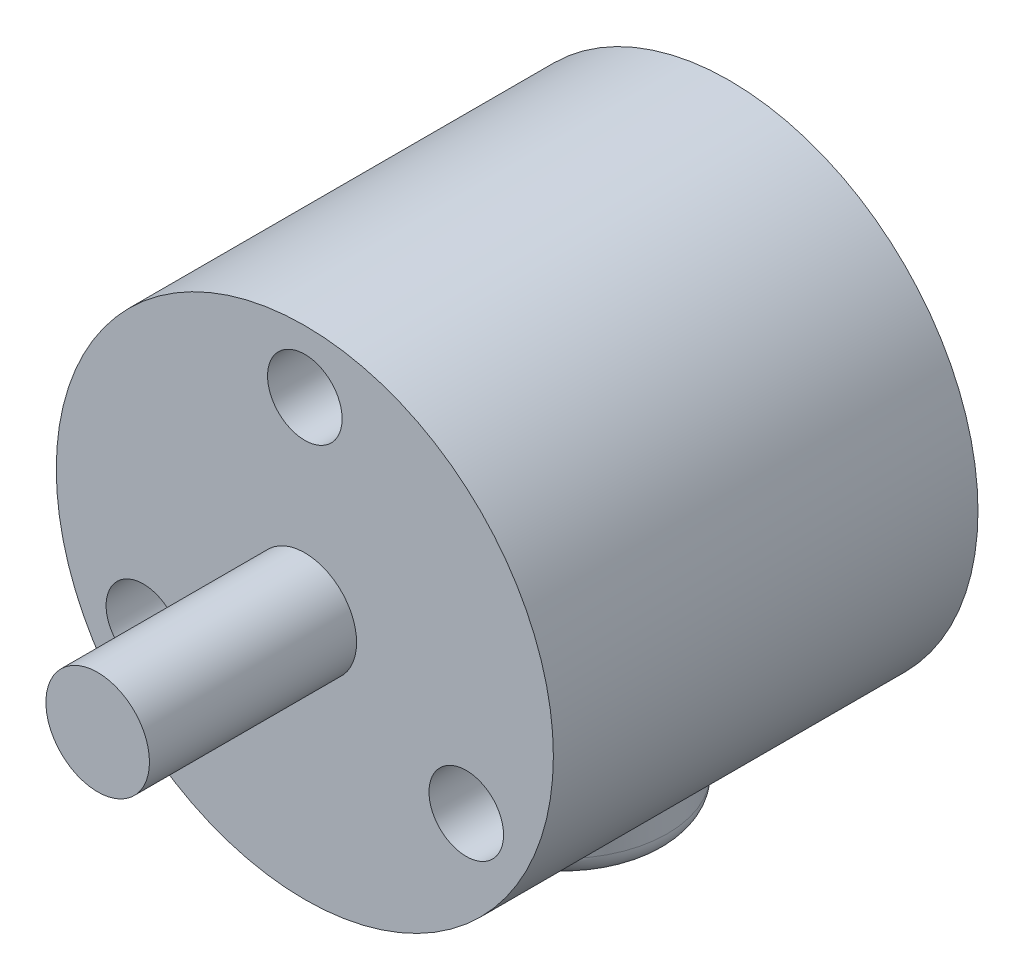
from build123d import *

# Parameters (mm, degrees)
ESQUISSE1_R             = 12
BOSS_EXTRU_1_DEPTH      = 20.5
ESQUISSE2_R             = 2.5
BOSS_EXTRU_2_DEPTH      = 3.5
ESQUISSE3_R             = 1.8
ENL_V_MAT_EXTRU_1_DEPTH = 3
ESQUISSE4_R             = 2.5
BOSS_EXTRU_3_DEPTH      = 6.5
ESQUISSE5_R             = 5
BOSS_EXTRU_4_DEPTH      = 14
CONG_1_R                = 1


with BuildPart() as part:
    # Esquisse1 → Boss.-Extru.1 (new body)
    with BuildSketch(Plane.XY):
        Circle(ESQUISSE1_R)
    extrude(amount=BOSS_EXTRU_1_DEPTH)

    # Esquisse2 → Boss.-Extru.2 (add)
    with BuildSketch(Plane.XY.offset(20.5)):
        Circle(ESQUISSE2_R)
    extrude(amount=BOSS_EXTRU_2_DEPTH)

    # Esquisse3 → Enlèv. mat.-Extru.1 (cut)
    with BuildSketch(Plane.XY.offset(20.5)):
        with Locations((0, 9)):
            Circle(ESQUISSE3_R)
        with Locations((-7.794228634, -4.5)):
            Circle(ESQUISSE3_R)
        with Locations((7.794228634, -4.5)):
            Circle(ESQUISSE3_R)
    extrude(amount=-ENL_V_MAT_EXTRU_1_DEPTH, mode=Mode.SUBTRACT)

    # Esquisse4 → Boss.-Extru.3 (add)
    with BuildSketch(Plane.XY.offset(24)):
        Circle(ESQUISSE4_R)
    extrude(amount=BOSS_EXTRU_3_DEPTH)

    # Esquisse5 → Boss.-Extru.4 (add)
    with BuildSketch(Plane(origin=(0, 0, 0), x_dir=(1, 0, 0), z_dir=(0, 1, 0))):
        with Locations(Location((0, -8, 0), (0, 0, 270))):
            Circle(ESQUISSE5_R)
    extrude(amount=-BOSS_EXTRU_4_DEPTH)

    # Congé1
    cong_1_edges = [part.edges().sort_by_distance(p)[0] for p in [
        (0, -14, 3),
    ]]
    fillet(cong_1_edges, radius=CONG_1_R)


solid = part.part
